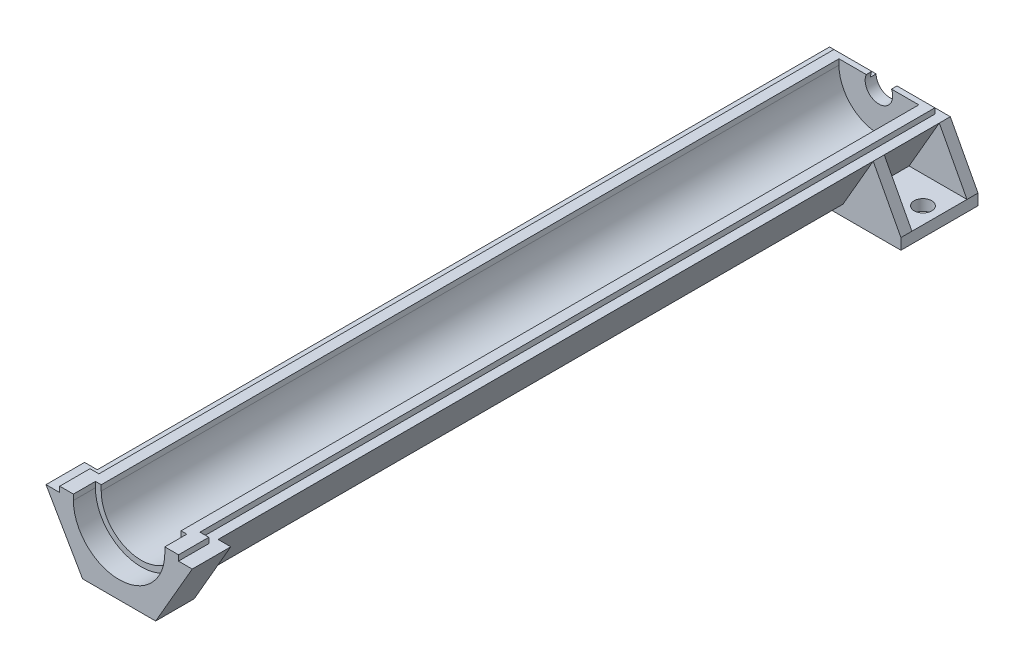
from build123d import *

# Parameters (mm, degrees)
AUFSATZ_LINEAR_AUSTRAGEN1_DEPTH  = 136
AUFSATZ_LINEAR_AUSTRAGEN2_DEPTH  = 2
AUFSATZ_LINEAR_AUSTRAGEN3_DEPTH  = 7
AUFSATZ_LINEAR_AUSTRAGEN6_DEPTH  = 2
LINEARES_MUSTER3_COUNT           = 2
LINEARES_MUSTER3_PITCH           = 12
SKIZZE12_W                       = 32
SKIZZE12_H                       = 14
SKIZZE12_R                       = 1.6
AUFSATZ_LINEAR_AUSTRAGEN14_DEPTH = 2
AUFSATZ_LINEAR_AUSTRAGEN15_DEPTH = 1
SCHNITT_LINEAR_START             = -2
SKIZZE14_R                       = 2.5
SCHNITT_LINEAR_AUSTRAGEN1_DEPTH  = 2


with BuildPart() as part:
    # Skizze1 → Aufsatz-Linear austragen1 (new body)
    with BuildSketch(Plane.XY):
        with BuildLine():
            Line((7.25, 0), (10.969655115, 0))
            Line((10.969655115, 0), (5.484827557, -9.5))
            Line((5.484827557, -9.5), (-5.484827557, -9.5))
            Line((-5.484827557, -9.5), (-10.969655115, 0))
            Line((-10.969655115, 0), (-7.25, 0))
            ThreePointArc((-7.25, 0), (0, -7.25), (7.25, 0))
        make_face()
    extrude(amount=AUFSATZ_LINEAR_AUSTRAGEN1_DEPTH)

    # Skizze2 → Aufsatz-Linear austragen2 (add)
    with BuildSketch(Plane.XY):
        with BuildLine():
            Line((7.25, 0), (-7.25, 0))
            ThreePointArc((-7.25, 0), (0, -7.25), (7.25, 0))
        make_face()
    extrude(amount=AUFSATZ_LINEAR_AUSTRAGEN2_DEPTH)

    # Skizze3 → Aufsatz-Linear austragen3 (add)
    with BuildSketch(Plane.XY.offset(133)):
        with BuildLine():
            Line((-8.3, 0), (-13.279056191, 0))
            Line((-13.279056191, 0), (-6.639528096, -11.5))
            Line((-6.639528096, -11.5), (6.639528096, -11.5))
            Line((6.639528096, -11.5), (13.279056191, 0))
            Line((13.279056191, 0), (8.3, 0))
            ThreePointArc((8.3, 0), (0, -8.3), (-8.3, 0))
        make_face()
    extrude(amount=AUFSATZ_LINEAR_AUSTRAGEN3_DEPTH)

    # Skizze7 → Aufsatz-Linear austragen6 (add)
    with BuildSketch(Plane.XY):
        Polygon((10.969655115, 0), (5.484827557, -9.5), (16, -9.5), align=None)
        Polygon((-5.484827557, -9.5), (-10.969655115, 0), (-16, -9.5), align=None)
    aufsatz_linear_austragen6 = extrude(amount=AUFSATZ_LINEAR_AUSTRAGEN6_DEPTH)

    # Lineares Muster3: Aufsatz-Linear austragen6 ×2
    with Locations(*[(0, 0, i * LINEARES_MUSTER3_PITCH) for i in range(1, LINEARES_MUSTER3_COUNT)]):
        add(aufsatz_linear_austragen6)

    # Skizze12 → Aufsatz-Linear austragen14 (add)
    with BuildSketch(Plane.XZ.offset(9.5)):
        with Locations((0, 7)):
            Rectangle(SKIZZE12_W, SKIZZE12_H)
        with Locations((-13, 7)):
            Circle(SKIZZE12_R, mode=Mode.SUBTRACT)
        with Locations((13, 7)):
            Circle(SKIZZE12_R, mode=Mode.SUBTRACT)
    extrude(amount=AUFSATZ_LINEAR_AUSTRAGEN14_DEPTH)

    # Skizze13 → Aufsatz-Linear austragen15 (add)
    with BuildSketch(Plane(origin=(0, 0, 0), x_dir=(1, 0, 0), z_dir=(0, 1, 0))):
        Polygon((8.3, -140), (10.789528096, -140), (10.789528096, -134.5), (9.169655115, -134.5), (9.169655115, -1), (-9.169655115, -1), (-9.169655115, -134.5), (-10.789528096, -134.5), (-10.789528096, -140), (-8.3, -140), (-8.3, -136), (-7.25, -136), (-7.25, -2), (7.25, -2), (7.25, -136), (8.3, -136), align=None)
    extrude(amount=AUFSATZ_LINEAR_AUSTRAGEN15_DEPTH)

    # Skizze14 → Schnitt-Linear austragen1 (cut)
    with BuildSketch(Plane(origin=(0, 0, 0), x_dir=(-1, 0, 0), z_dir=(0, 0, -1)).offset(SCHNITT_LINEAR_START)):
        Circle(SKIZZE14_R)
    extrude(amount=SCHNITT_LINEAR_AUSTRAGEN1_DEPTH, mode=Mode.SUBTRACT)


solid = part.part
